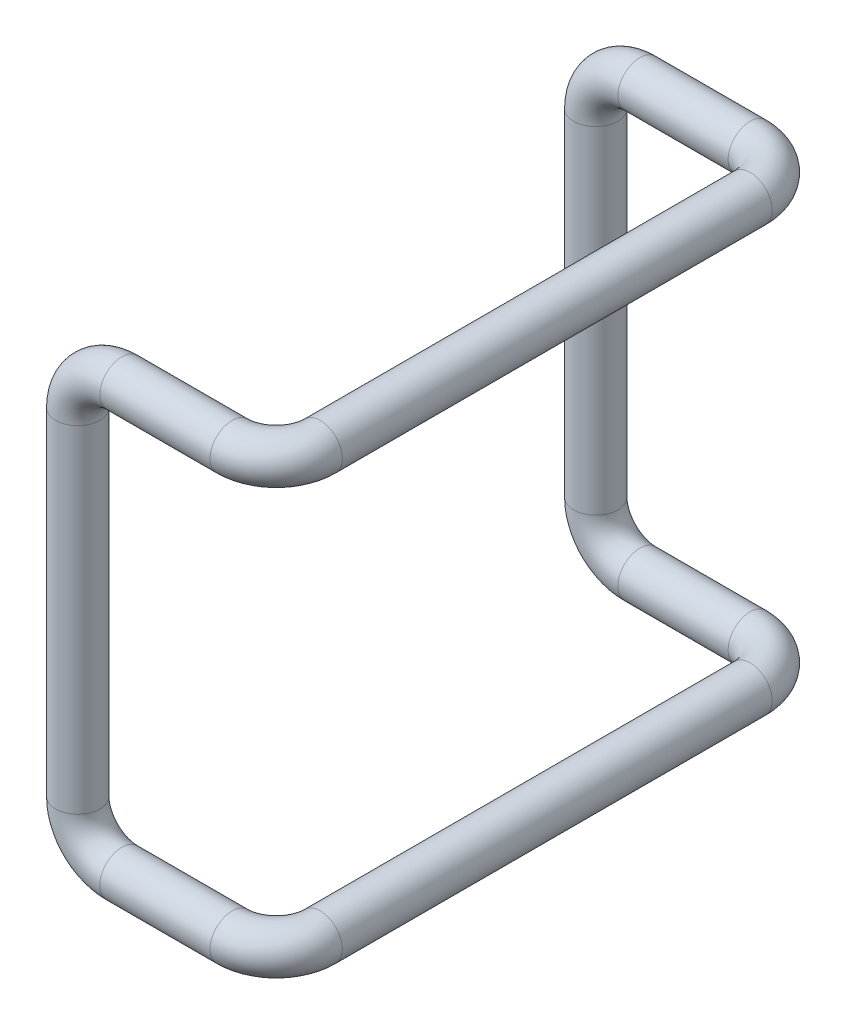
from build123d import *

# Parameters (mm, degrees)
SKETCH2_R = 1.27


with BuildPart() as part:
    # Sweep1: sweep along a curve in space
    with BuildLine() as sweep1_path:
        Line((2.54, 12.23137, 14.91742), (8.89, 12.23137, 14.91742))
        ThreePointArc((8.89, 12.23137, 14.91742), (10.686051224, 12.23137, 14.173471224), (11.43, 12.23137, 12.37742))
        Line((11.43, 12.23137, -12.37742), (11.43, 12.23137, 12.37742))
        ThreePointArc((11.43, 12.23137, -12.37742), (10.686051224, 12.23137, -14.173471224), (8.89, 12.23137, -14.91742))
        Line((2.54, 12.23137, -14.91742), (8.89, 12.23137, -14.91742))
        ThreePointArc((2.54, 12.23137, -14.91742), (0.743948776, 11.487421224, -14.91742), (0, 9.69137, -14.91742))
        Line((0, 9.69137, -14.91742), (0, -9.69137, -14.91742))
        ThreePointArc((0, -9.69137, -14.91742), (0.743948776, -11.487421224, -14.91742), (2.54, -12.23137, -14.91742))
        Line((2.54, -12.23137, -14.91742), (8.89, -12.23137, -14.91742))
        ThreePointArc((8.89, -12.23137, -14.91742), (10.686051224, -12.23137, -14.173471224), (11.43, -12.23137, -12.37742))
        Line((11.43, -12.23137, 12.37742), (11.43, -12.23137, -12.37742))
        ThreePointArc((11.43, -12.23137, 12.37742), (10.686051224, -12.23137, 14.173471224), (8.89, -12.23137, 14.91742))
        Line((2.54, -12.23137, 14.91742), (8.89, -12.23137, 14.91742))
        ThreePointArc((2.54, -12.23137, 14.91742), (0.743948776, -11.487421224, 14.91742), (0, -9.69137, 14.91742))
        Line((0, 9.69137, 14.91742), (0, -9.69137, 14.91742))
        ThreePointArc((0, 9.69137, 14.91742), (0.743948776, 11.487421224, 14.91742), (2.54, 12.23137, 14.91742))
    # Sketch2 → Sweep1 (sweep)
    with BuildSketch(Plane.XY):
        with Locations((11.43, 12.23137)):
            Circle(SKETCH2_R)
    sweep(path=sweep1_path.line)


solid = part.part
